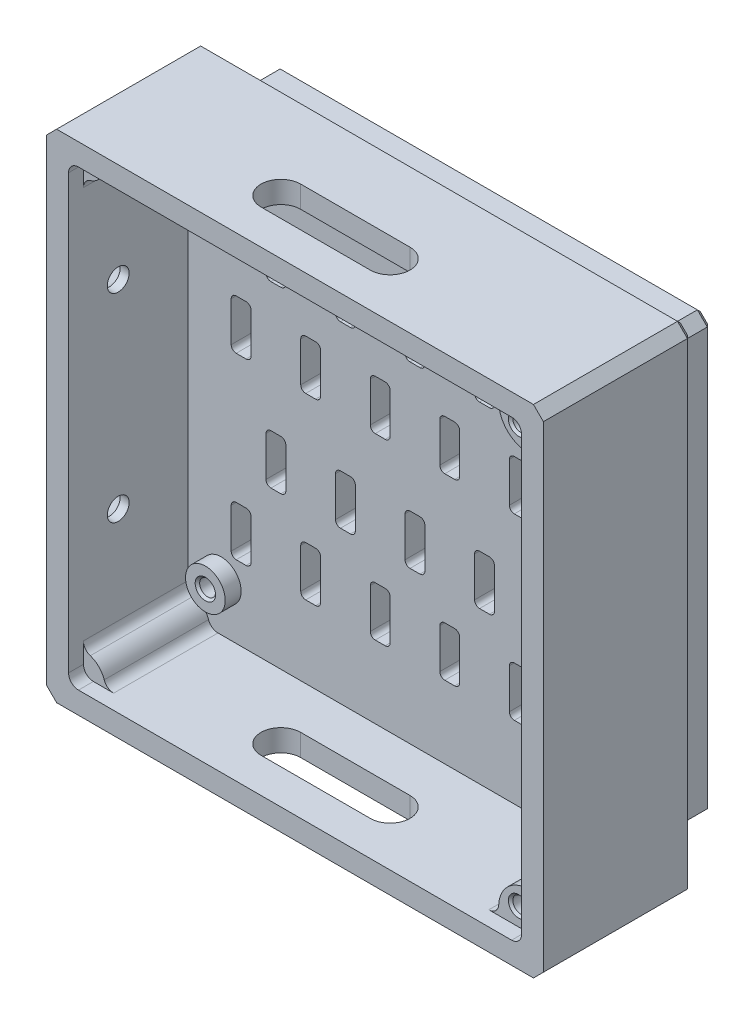
from build123d import *

# Parameters (mm, degrees)
SKETCH_1_W                     = 50
SKETCH_1_H                     = 50
EXTRUDE_1_DEPTH                = 20
SKETCH_2_W                     = 45.6
SKETCH_2_H                     = 45.6
CUT_EXTRUDE_1_DEPTH            = 12
SKETCH_3_R                     = 2
EXTRUDE_2_DEPTH                = 1.6
HOLE_WIZARD_M2_1_D             = 1.6
HOLE_WIZARD_M2_1_DEPTH         = 6
HOLE_WIZARD_M2_1_CSINK_D       = 2.05
HOLE_WIZARD_M2_1_CSINK_ANGLE   = 90
HOLE_WIZARD_M2_1_TIP           = 0.480688495
SKETCH_8_R                     = 2.2
SKETCH_8_R_2                   = 3
EXTRUDE_7_DEPTH                = 10.5
FILLET_1_R                     = 1
HOLE_WIZARD_M2_4_D             = 1.6
HOLE_WIZARD_M2_4_DEPTH         = 6
HOLE_WIZARD_M2_4_CSINK_D       = 2.05
HOLE_WIZARD_M2_4_CSINK_ANGLE   = 90
HOLE_WIZARD_M2_4_TIP           = 0.480688495
SKETCH_16_R                    = 1.1
CUT_EXTRUDE_2_DEPTH            = 11.5
CHAMFER_1_SIZE                 = 0.9
CHAMFER_1_SIZE2                = 1.3
CUT_EXTRUDE_3_DEPTH            = 3
SKETCH_18_W                    = 50
SKETCH_18_H                    = 50
SKETCH_18_W_2                  = 44
SKETCH_18_H_2                  = 44
CUT_EXTRUDE_4_DEPTH            = 5
CHAMFER_2_SIZE                 = 1
SKETCH_19_W                    = 2
SKETCH_19_H                    = 5
CUT_EXTRUDE_5_DEPTH            = 41.620192023
FILLET_2_R                     = 0.5
PATTERN_LINEAR_1_COUNT         = 5
PATTERN_LINEAR_1_PITCH         = 7
FILLET_2_OF_PATTERN_LINEAR_1_R = 0.5
SKETCH_20_W                    = 2
SKETCH_20_H                    = 5
CUT_EXTRUDE_6_DEPTH            = 41.620192023
FILLET_3_R                     = 0.5
PATTERN_LINEAR_2_COUNT         = 5
PATTERN_LINEAR_2_PITCH         = 7
FILLET_3_OF_PATTERN_LINEAR_2_R = 0.5
CHAMFER_3_SIZE                 = 0.5
CUT_EXTRUDE_START              = -10
CUT_EXTRUDE_11_DEPTH           = 10


with BuildPart() as part:
    # 草图1 → 凸台-拉伸1 (new body)
    with BuildSketch(Plane.XY):
        Rectangle(SKETCH_1_W, SKETCH_1_H)
    extrude(amount=EXTRUDE_1_DEPTH)

    # 草图2 → 切除-拉伸1 (cut)
    with BuildSketch(Plane.XY.offset(20)):
        Rectangle(SKETCH_2_W, SKETCH_2_H)
    extrude(amount=-CUT_EXTRUDE_1_DEPTH, mode=Mode.SUBTRACT)

    # 草图3 → 凸台-拉伸2 (add)
    with BuildSketch(Plane.XY.offset(8)):
        with Locations((-19.426995174, 18.00003429)):
            Circle(SKETCH_3_R)
        with Locations((16.573075946, 18.00003429)):
            Circle(SKETCH_3_R)
        with Locations((16.573075946, -18.00003683)):
            Circle(SKETCH_3_R)
        with Locations((-19.426995174, -18.00003683)):
            Circle(SKETCH_3_R)
    extrude(amount=EXTRUDE_2_DEPTH)

    # M2 螺纹孔1
    with Locations(Plane.XY.offset(9.6)):
        with Locations((-19.426995174, 18.00003429), (16.573075946, 18.00003429), (16.573075946, -18.00003683), (-19.426995174, -18.00003683)):
            CounterSinkHole(HOLE_WIZARD_M2_1_D / 2, HOLE_WIZARD_M2_1_CSINK_D / 2, depth=HOLE_WIZARD_M2_1_DEPTH, counter_sink_angle=HOLE_WIZARD_M2_1_CSINK_ANGLE)
            with Locations((0, 0, -(HOLE_WIZARD_M2_1_DEPTH + HOLE_WIZARD_M2_1_TIP / 2))):  # 118° drill point
                Cone(0, HOLE_WIZARD_M2_1_D / 2, HOLE_WIZARD_M2_1_TIP, mode=Mode.SUBTRACT)

    # 草图8 → 凸台-拉伸7 (add)
    with BuildSketch(Plane.XY.offset(8)):
        with Locations((-22.8, 22.8)):
            Circle(SKETCH_8_R)
        with Locations((22, 22)):
            Circle(SKETCH_8_R_2)
        with Locations((-22.8, -22.8)):
            Circle(SKETCH_8_R)
        with Locations((22, -22)):
            Circle(SKETCH_8_R_2)
    extrude(amount=EXTRUDE_7_DEPTH)

    # 圆角1
    fillet_1_edges = [part.edges().sort_by_distance(p)[0] for p in [
        (-22.8, -22.8, 19.25),
        (-22.8, -20.6, 13.25),
        (-20.6, -22.8, 13.25),
        (22.8, -22.8, 19.25),
        (19.108633541, -22.8, 13.25),
        (22.8, -19.108633541, 13.25),
        (-22.8, 22.8, 19.25),
        (-22.8, 20.6, 13.25),
        (-20.6, 22.8, 13.25),
        (22.8, 22.8, 19.25),
        (19.108633541, 22.8, 13.25),
        (22.8, 19.108633541, 13.25),
    ]]
    fillet(fillet_1_edges, radius=FILLET_1_R)

    # M2 螺纹孔4
    with Locations(Plane.XY.offset(18.5)):
        with Locations((21, 21), (21, -21)):
            CounterSinkHole(HOLE_WIZARD_M2_4_D / 2, HOLE_WIZARD_M2_4_CSINK_D / 2, depth=HOLE_WIZARD_M2_4_DEPTH, counter_sink_angle=HOLE_WIZARD_M2_4_CSINK_ANGLE)
            with Locations((0, 0, -(HOLE_WIZARD_M2_4_DEPTH + HOLE_WIZARD_M2_4_TIP / 2))):  # 118° drill point
                Cone(0, HOLE_WIZARD_M2_4_D / 2, HOLE_WIZARD_M2_4_TIP, mode=Mode.SUBTRACT)

    # 草图16 → 切除-拉伸2 (cut)
    with BuildSketch(Plane.ZY.offset(25)):
        with Locations(Location((15, 10, 0), (0, 0, 270))):
            Circle(SKETCH_16_R)
        with Locations(Location((15, -10, 0), (0, 0, 270))):
            Circle(SKETCH_16_R)
    extrude(amount=-CUT_EXTRUDE_2_DEPTH, mode=Mode.SUBTRACT)

    # 倒角1
    chamfer_1_edges = [part.edges().sort_by_distance(p)[0] for p in [
        (-25, 11.1, 15),
        (-25, -8.9, 15),
    ]]
    chamfer_1_side = [part.faces().sort_by_distance(p)[0] for p in [
        (-25, 0, 9.961695513),
    ]]
    chamfer(chamfer_1_edges, length=CHAMFER_1_SIZE, length2=CHAMFER_1_SIZE2, reference=chamfer_1_side[0])

    # 草图17 → 切除-拉伸3 (cut)
    with BuildSketch(Plane(origin=(0, 25, 0), x_dir=(1, 0, 0), z_dir=(0, 1, 0))):
        with BuildLine():
            Line((-6.926960884, -12.5), (4.073039116, -12.5))
            ThreePointArc((4.073039116, -12.5), (6.073039116, -14.5), (4.073039116, -16.5))
            Line((4.073039116, -16.5), (-6.926960884, -16.5))
            ThreePointArc((-6.926960884, -16.5), (-8.926960884, -14.5), (-6.926960884, -12.5))
        make_face()
    extrude(amount=-CUT_EXTRUDE_3_DEPTH, mode=Mode.SUBTRACT)

    # 草图18 → 切除-拉伸4 (cut)
    with BuildSketch(Plane(origin=(0, 0, 0), x_dir=(-1, 0, 0), z_dir=(0, 0, -1))):
        Rectangle(SKETCH_18_W, SKETCH_18_H)
        Rectangle(SKETCH_18_W_2, SKETCH_18_H_2, mode=Mode.SUBTRACT)
    extrude(amount=-CUT_EXTRUDE_4_DEPTH, mode=Mode.SUBTRACT)

    # 倒角2
    chamfer_2_edges = [part.edges().sort_by_distance(p)[0] for p in [
        (-22, 22, 2.5),
        (-22, -22, 2.5),
        (22, -22, 2.5),
        (22, 22, 2.5),
        (25, -25, 12.5),
        (-25, -25, 12.5),
        (-25, 25, 12.5),
        (25, 25, 12.5),
    ]]
    chamfer(chamfer_2_edges, length=CHAMFER_2_SIZE)

    # 草图19 → 切除-拉伸5 (cut, through all)
    with BuildSketch(Plane(origin=(0, 0, 0), x_dir=(-1, 0, 0), z_dir=(0, 0, -1))):
        with Locations((-14.073070866, 13.00002413)):
            Rectangle(SKETCH_19_W, SKETCH_19_H)
        with Locations((-14.073070866, -5.00001143)):
            Rectangle(SKETCH_19_W, SKETCH_19_H)
    cut_extrude_5 = extrude(amount=-CUT_EXTRUDE_5_DEPTH, mode=Mode.SUBTRACT)

    # 圆角2
    fillet_2_edges = [part.edges().sort_by_distance(p)[0] for p in [
        (15.073070866, 10.50002413, 4),
        (15.073070866, 15.50002413, 4),
        (13.073070866, 15.50002413, 4),
        (13.073070866, 10.50002413, 4),
        (15.073070866, -7.50001143, 4),
        (15.073070866, -2.50001143, 4),
        (13.073070866, -2.50001143, 4),
        (13.073070866, -7.50001143, 4),
    ]]
    fillet(fillet_2_edges, radius=FILLET_2_R)

    # 阵列(线性)1: 切除-拉伸5 ×5
    with Locations(*[(-i * PATTERN_LINEAR_1_PITCH, 0, 0) for i in range(1, PATTERN_LINEAR_1_COUNT)]):
        add(cut_extrude_5, mode=Mode.SUBTRACT)

    # 圆角2 of 阵列(线性)1
    fillet_2_of_pattern_linear_1_edges = [part.edges().sort_by_distance(p)[0] for p in [
        (8.073070866, 10.50002413, 4),
        (8.073070866, 15.50002413, 4),
        (6.073070866, 15.50002413, 4),
        (6.073070866, 10.50002413, 4),
        (8.073070866, -7.50001143, 4),
        (8.073070866, -2.50001143, 4),
        (6.073070866, -2.50001143, 4),
        (6.073070866, -7.50001143, 4),
        (1.073070866, 10.50002413, 4),
        (1.073070866, 15.50002413, 4),
        (-0.926929134, 15.50002413, 4),
        (-0.926929134, 10.50002413, 4),
        (1.073070866, -7.50001143, 4),
        (1.073070866, -2.50001143, 4),
        (-0.926929134, -2.50001143, 4),
        (-0.926929134, -7.50001143, 4),
        (-5.926929134, 10.50002413, 4),
        (-5.926929134, 15.50002413, 4),
        (-7.926929134, 15.50002413, 4),
        (-7.926929134, 10.50002413, 4),
        (-5.926929134, -7.50001143, 4),
        (-5.926929134, -2.50001143, 4),
        (-7.926929134, -2.50001143, 4),
        (-7.926929134, -7.50001143, 4),
        (-12.926929134, 10.50002413, 4),
        (-12.926929134, 15.50002413, 4),
        (-14.926929134, 15.50002413, 4),
        (-14.926929134, 10.50002413, 4),
        (-12.926929134, -7.50001143, 4),
        (-12.926929134, -2.50001143, 4),
        (-14.926929134, -2.50001143, 4),
        (-14.926929134, -7.50001143, 4),
    ]]
    fillet(fillet_2_of_pattern_linear_1_edges, radius=FILLET_2_OF_PATTERN_LINEAR_1_R)

    # 草图20 → 切除-拉伸6 (cut, through all)
    with BuildSketch(Plane(origin=(0, 0, 0), x_dir=(-1, 0, 0), z_dir=(0, 0, -1))):
        with Locations((-10.573063246, 5.00000889)):
            Rectangle(SKETCH_20_W, SKETCH_20_H)
        with Locations((-10.573063246, -13.00002667)):
            Rectangle(SKETCH_20_W, SKETCH_20_H)
    cut_extrude_6 = extrude(amount=-CUT_EXTRUDE_6_DEPTH, mode=Mode.SUBTRACT)

    # 圆角3
    fillet_3_edges = [part.edges().sort_by_distance(p)[0] for p in [
        (11.573063246, 2.50000889, 4),
        (11.573063246, 7.50000889, 4),
        (9.573063246, 7.50000889, 4),
        (9.573063246, 2.50000889, 4),
        (11.573063246, -15.50002667, 4),
        (11.573063246, -10.50002667, 4),
        (9.573063246, -10.50002667, 4),
        (9.573063246, -15.50002667, 4),
    ]]
    fillet(fillet_3_edges, radius=FILLET_3_R)

    # 阵列(线性)2: 切除-拉伸6 ×5
    with Locations(*[(-i * PATTERN_LINEAR_2_PITCH, 0, 0) for i in range(1, PATTERN_LINEAR_2_COUNT)]):
        add(cut_extrude_6, mode=Mode.SUBTRACT)

    # 圆角3 of 阵列(线性)2
    fillet_3_of_pattern_linear_2_edges = [part.edges().sort_by_distance(p)[0] for p in [
        (4.573063246, 2.50000889, 4),
        (4.573063246, 7.50000889, 4),
        (2.573063246, 7.50000889, 4),
        (2.573063246, 2.50000889, 4),
        (4.573063246, -15.50002667, 4),
        (4.573063246, -10.50002667, 4),
        (2.573063246, -10.50002667, 4),
        (2.573063246, -15.50002667, 4),
        (-2.426936754, 2.50000889, 4),
        (-2.426936754, 7.50000889, 4),
        (-4.426936754, 7.50000889, 4),
        (-4.426936754, 2.50000889, 4),
        (-2.426936754, -15.50002667, 4),
        (-2.426936754, -10.50002667, 4),
        (-4.426936754, -10.50002667, 4),
        (-4.426936754, -15.50002667, 4),
        (-9.426936754, 2.50000889, 4),
        (-9.426936754, 7.50000889, 4),
        (-11.426936754, 7.50000889, 4),
        (-11.426936754, 2.50000889, 4),
        (-9.426936754, -15.50002667, 4),
        (-9.426936754, -10.50002667, 4),
        (-11.426936754, -10.50002667, 4),
        (-11.426936754, -15.50002667, 4),
        (-16.426936754, 2.50000889, 4),
        (-16.426936754, 7.50000889, 4),
        (-18.426936754, 7.50000889, 4),
        (-18.426936754, 2.50000889, 4),
        (-16.426936754, -15.50002667, 4),
        (-16.426936754, -10.50002667, 4),
        (-18.426936754, -10.50002667, 4),
        (-18.426936754, -15.50002667, 4),
    ]]
    fillet(fillet_3_of_pattern_linear_2_edges, radius=FILLET_3_OF_PATTERN_LINEAR_2_R)

    # 倒角3
    chamfer_3_edges = [part.edges().sort_by_distance(p)[0] for p in [
        (0, -22, 0),
        (0, 22, 0),
        (22, 0, 0),
        (-22, 0, 0),
        (-21.5, 21.5, 0),
        (21.5, 21.5, 0),
        (21.5, -21.5, 0),
        (-21.5, -21.5, 0),
        (-25, 0, 5),
        (0, 25, 5),
        (25, 0, 5),
        (0, -25, 5),
        (24.5, 24.5, 5),
        (24.5, -24.5, 5),
        (-24.5, -24.5, 5),
        (-24.5, 24.5, 5),
    ]]
    chamfer(chamfer_3_edges, length=CHAMFER_3_SIZE)

    # 草图24 → 切除-拉伸11 (cut)
    with BuildSketch(Plane.XZ.offset(25).offset(CUT_EXTRUDE_START)):
        with BuildLine():
            Line((-6.926960884, 16.5), (4.073039116, 16.5))
            ThreePointArc((4.073039116, 16.5), (6.073039116, 14.5), (4.073039116, 12.5))
            Line((4.073039116, 12.5), (-6.926960884, 12.5))
            ThreePointArc((-6.926960884, 12.5), (-8.926960884, 14.5), (-6.926960884, 16.5))
        make_face()
    extrude(amount=CUT_EXTRUDE_11_DEPTH, mode=Mode.SUBTRACT)


solid = part.part
